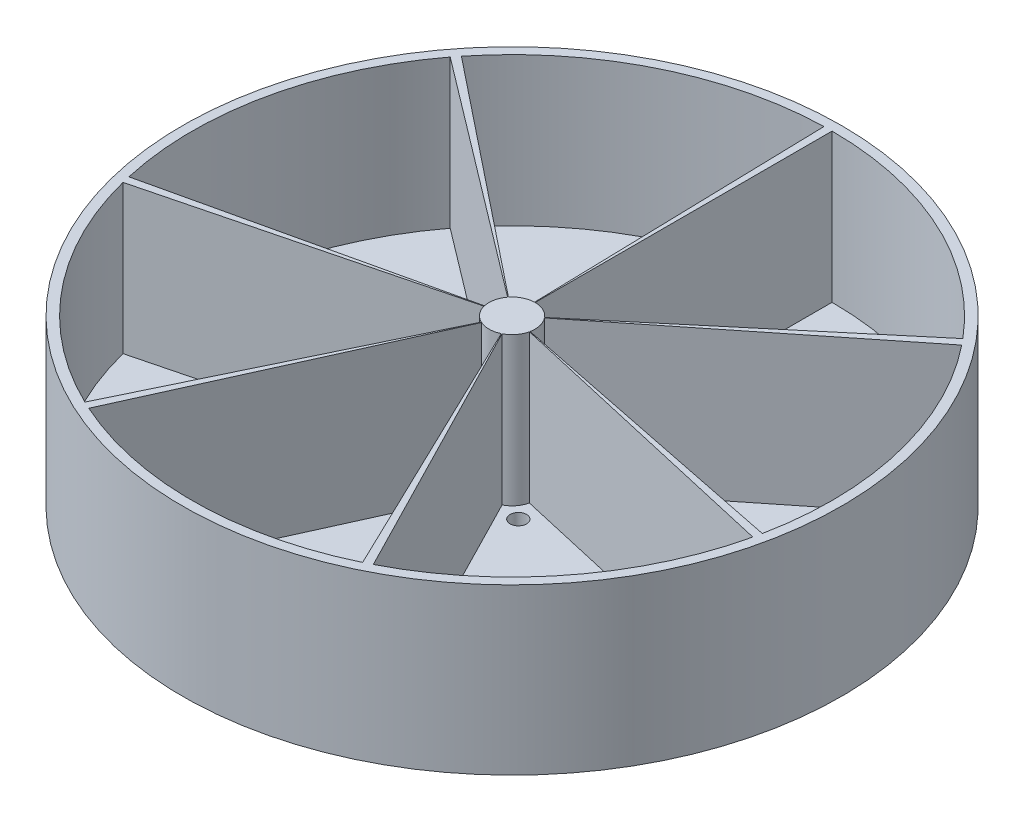
from build123d import *

# Parameters (mm, degrees)
SKETCH1_W          = 100
SKETCH1_H          = 50
CUT_EXTRUDE4_DEPTH = 45
SKETCH3_R          = 2.5
CUT_EXTRUDE5_DEPTH = 10


with BuildPart() as part:
    # Sketch1 → Revolve1 (revolve)
    with BuildSketch(Plane.XY, mode=Mode.PRIVATE) as revolve1_sk:
        with Locations((50, 25)):
            Rectangle(SKETCH1_W, SKETCH1_H)
    revolve(revolve1_sk.sketch.rotate(Axis((0, 0, 0), (0, 1, 0)), 90), axis=Axis((0, 0, 0), (0, 1, 0)))

    # Sketch2 → Cut-Extrude4 (cut)
    with BuildSketch(Plane(origin=(0, 50, 0), x_dir=(1, 0, 0), z_dir=(0, 1, 0))):
        with BuildLine():
            Line((0, 7), (0, 97.092153024))
            ThreePointArc((0, 97.092153024), (41.03291694, 87.995374346), (74.376904295, 62.409632962))
            Line((74.376904295, 62.409632962), (5.362311102, 4.499513268))
            ThreePointArc((5.362311102, 4.499513268), (2.958327832, 6.344154509), (0, 7))
        make_face()
        with BuildLine():
            Line((5.472820377, 4.364428613), (75.909701935, 60.535967251))
            ThreePointArc((75.909701935, 60.535967251), (94.381159228, 22.783392234), (95.16705718, -19.238435657))
            Line((95.16705718, -19.238435657), (6.861207415, -1.387023002))
            ThreePointArc((6.861207415, -1.387023002), (6.804546959, 1.642601803), (5.472820377, 4.364428613))
        make_face()
        with BuildLine():
            Line((6.824495385, -1.557646538), (94.657850037, -21.605036571))
            ThreePointArc((94.657850037, -21.605036571), (76.658463592, -59.584948926), (44.294474955, -86.399569833))
            Line((44.294474955, -86.399569833), (3.193474601, -6.229102662))
            ThreePointArc((3.193474601, -6.229102662), (5.526803438, -4.295863564), (6.824495385, -1.557646538))
        make_face()
        with BuildLine():
            Line((3.037186174, -6.306782075), (42.126706393, -87.477007192))
            ThreePointArc((42.126706393, -87.477007192), (1.210381324, -97.084608234), (-39.932750354, -88.500065695))
            Line((-39.932750354, -88.500065695), (-2.879009722, -6.380540966))
            ThreePointArc((-2.879009722, -6.380540966), (0.087264202, -6.999456047), (3.037186174, -6.306782075))
        make_face()
        with BuildLine():
            Line((-3.037186174, -6.306782075), (-42.126706393, -87.477007192))
            ThreePointArc((-42.126706393, -87.477007192), (-75.149142768, -61.477577376), (-94.089800167, -23.958207016))
            Line((-94.089800167, -23.958207016), (-6.783541004, -1.727301784))
            ThreePointArc((-6.783541004, -1.727301784), (-5.417986758, -4.432315365), (-3.037186174, -6.306782075))
        make_face()
        with BuildLine():
            Line((-6.824495385, -1.557646538), (-94.657850037, -21.605036571))
            ThreePointArc((-94.657850037, -21.605036571), (-94.919829593, 20.423323159), (-77.395311372, 58.624670204))
            Line((-77.395311372, 58.624670204), (-5.579927551, 4.226630872))
            ThreePointArc((-5.579927551, 4.226630872), (-6.843383182, 1.47244919), (-6.824495385, -1.557646538))
        make_face()
        with BuildLine():
            Line((-5.472820377, 4.364428613), (-75.909701935, 60.535967251))
            ThreePointArc((-75.909701935, 60.535967251), (-43.213948723, 86.945044796), (-2.420574537, 97.061975035))
            Line((-2.420574537, 97.061975035), (-0.174514842, 6.997824274))
            ThreePointArc((-0.174514842, 6.997824274), (-3.115572491, 6.268429473), (-5.472820377, 4.364428613))
        make_face()
    extrude(amount=-CUT_EXTRUDE4_DEPTH, mode=Mode.SUBTRACT)

    # Sketch3 → Cut-Extrude5 (cut)
    with BuildSketch(Plane.XZ):
        with Locations(Location((0, 11, 0), (0, 0, 270))):
            Circle(SKETCH3_R)
        with Locations(Location((9.38197779, 7.481877622, 0), (0, 0, 270))):
            Circle(SKETCH3_R)
        with Locations(Location((12.480966429, -2.046761406, 0), (0, 0, 270))):
            Circle(SKETCH3_R)
        with Locations(Location((6.963364264, -10.410657547, 0), (0, 0, 270))):
            Circle(SKETCH3_R)
        with Locations(Location((-3.015961736, -11.311626415, 0), (0, 0, 270))):
            Circle(SKETCH3_R)
        with Locations(Location((-9.942375552, -4.071220075, 0), (0, 0, 270))):
            Circle(SKETCH3_R)
        with Locations(Location((-8.600146307, 5.85838782, 0), (0, 0, 270))):
            Circle(SKETCH3_R)
    extrude(amount=-CUT_EXTRUDE5_DEPTH, mode=Mode.SUBTRACT)


solid = part.part
